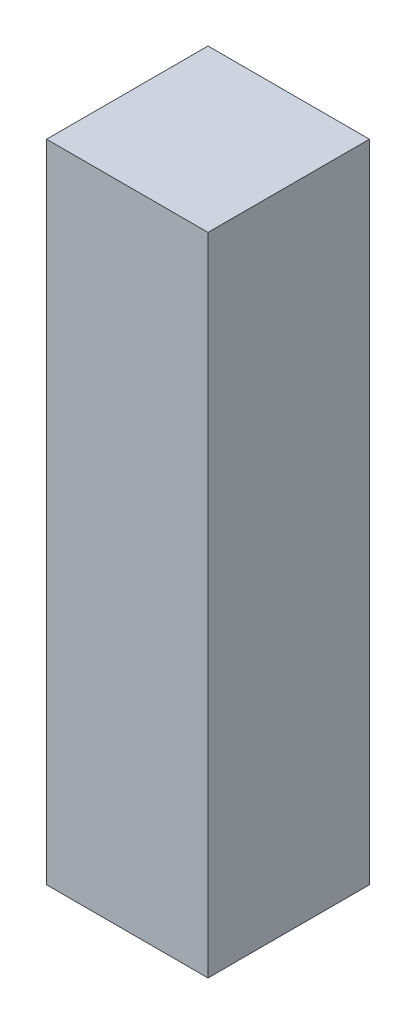
from build123d import *

# Parameters (mm, degrees)
SKETCH_1_W      = 20
SKETCH_1_H      = 20
EXTRUDE_1_DEPTH = 80


with BuildPart() as part:
    # 草图1 → 凸台-拉伸1 (new body)
    with BuildSketch(Plane(origin=(0, 0, 0), x_dir=(1, 0, 0), z_dir=(0, 1, 0))):
        Rectangle(SKETCH_1_W, SKETCH_1_H)
    extrude(amount=EXTRUDE_1_DEPTH)


solid = part.part
